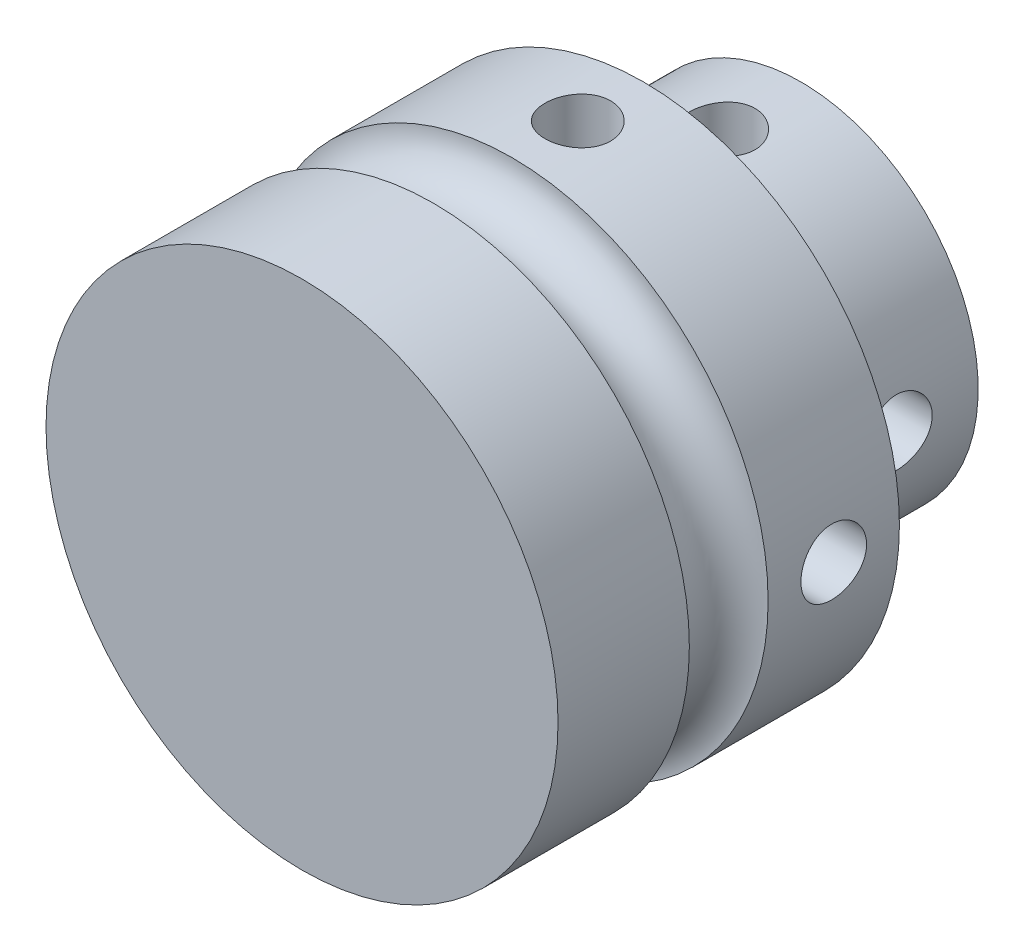
from build123d import *

# Parameters (mm, degrees)
ESBO_O2_R                = 9.75
RESSALTO_EXTRUS_O1_DEPTH = 13
ESBO_O3_R                = 1.5
ESBO_O4_R                = 6.75
RESSALTO_EXTRUS_O2_DEPTH = 6
PADR_OCIRCULAR1_COUNT    = 4
PADR_OCIRCULAR2_COUNT    = 4


with BuildPart() as part:
    # Esboço2 → Ressalto-extrusão1 (new body)
    with BuildSketch(Plane.XY):
        with Locations(Location((0, 0, 0), (0, 0, 180))):
            Circle(ESBO_O2_R)
    extrude(amount=RESSALTO_EXTRUS_O1_DEPTH)

    # Esboço3 → Corte-Revolução1 (revolve, cut)
    with BuildSketch(Plane(origin=(0, 0, 0), x_dir=(1, 0, 0), z_dir=(0, 1, 0)), mode=Mode.PRIVATE) as corte_revolu_o1_sk:
        with Locations((9.75, -6.5)):
            Circle(ESBO_O3_R)
    revolve(corte_revolu_o1_sk.sketch.rotate(Axis((0, 0, 0), (0, 0, 1)), 180), axis=Axis((0, 0, 0), (0, 0, 1)), mode=Mode.SUBTRACT)

    # Esboço4 → Ressalto-extrusão2 (add)
    with BuildSketch(Plane(origin=(0, 0, 0), x_dir=(-1, 0, 0), z_dir=(0, 0, -1))):
        Circle(ESBO_O4_R)
    extrude(amount=RESSALTO_EXTRUS_O2_DEPTH)

    # Esboço15 → Broca de rosquear para tarraxa de M36 (revolve, cut)
    with BuildSketch(Plane(origin=(0, 9.75, 2.5), x_dir=(0, 0, 1), z_dir=(1, 0, 0))):
        Polygon((0, 0), (0, 8.751075774), (1.25, 8), (1.25, 0), align=None)
    broca_de_rosquear_para_tarraxa_de_m36 = revolve(axis=Axis((0, 16.1, 2.5), (0, -1, 0)), mode=Mode.SUBTRACT)

    # PadrãoCircular1: Broca de rosquear para tarraxa de M36 ×4 about axis
    padr_ocircular1_axis = Axis((0, 0, 0), (0, 0, 1))
    for i in range(1, PADR_OCIRCULAR1_COUNT):
        add(broca_de_rosquear_para_tarraxa_de_m36.rotate(padr_ocircular1_axis, i * 360 / PADR_OCIRCULAR1_COUNT), mode=Mode.SUBTRACT)

    # Esboço19 → Broca de rosquear para tarraxa de M310 (revolve, cut)
    with BuildSketch(Plane(origin=(0, 6.75, -3), x_dir=(0, 0, 1), z_dir=(1, 0, 0))):
        Polygon((0, 0), (0, 5.751075774), (1.25, 5), (1.25, 0), align=None)
    broca_de_rosquear_para_tarraxa_de_m310 = revolve(axis=Axis((0, 13.1, -3), (0, -1, 0)), mode=Mode.SUBTRACT)

    # PadrãoCircular2: Broca de rosquear para tarraxa de M310 ×4 about axis
    padr_ocircular2_axis = Axis((0, 0, 0), (0, 0, 1))
    for i in range(1, PADR_OCIRCULAR2_COUNT):
        add(broca_de_rosquear_para_tarraxa_de_m310.rotate(padr_ocircular2_axis, i * 360 / PADR_OCIRCULAR2_COUNT), mode=Mode.SUBTRACT)


solid = part.part
